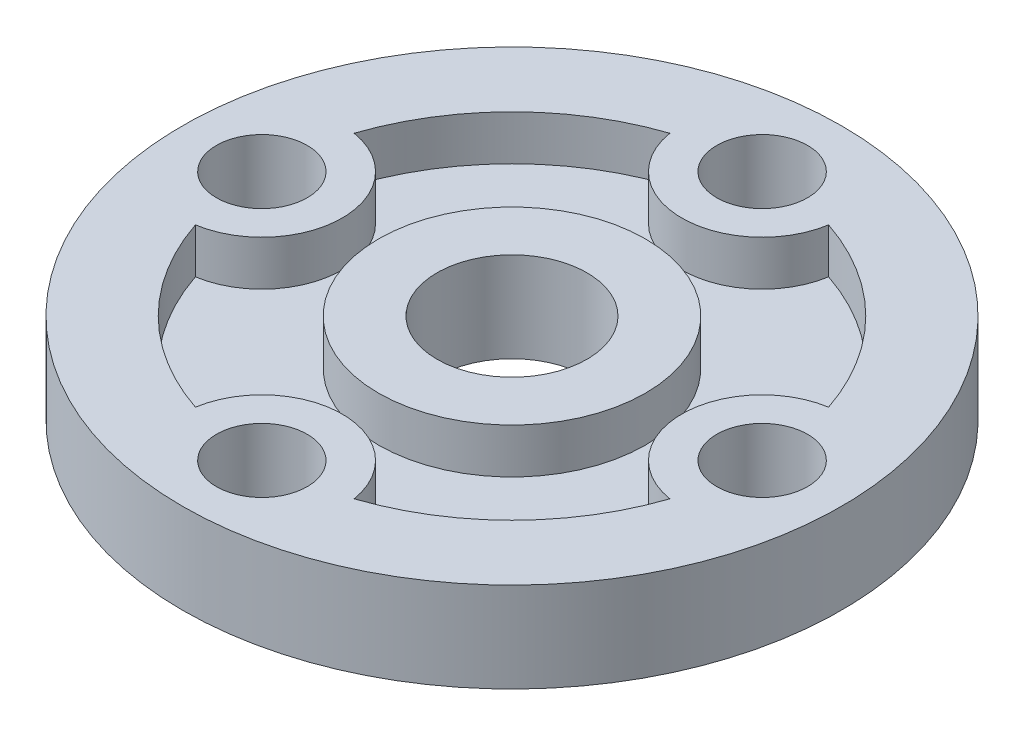
from build123d import *

# Parameters (mm, degrees)
SKETCH1_R           = 73.214752718
BOSS_EXTRUDE4_DEPTH = 20
SKETCH1_7_R         = 10.088971545
SKETCH1_7_R_2       = 16.661107431
CUT_EXTRUDE2_DEPTH  = 20
SKETCH1_8_R         = 29.667707344
CUT_EXTRUDE3_DEPTH  = 10


with BuildPart() as part:
    # Sketch1 → Boss-Extrude4 (new body)
    with BuildSketch(Plane(origin=(0, 0, 0), x_dir=(1, 0, 0), z_dir=(0, 1, 0))):
        Circle(SKETCH1_R)
    extrude(amount=-BOSS_EXTRUDE4_DEPTH)

    # Sketch1<7> → Cut-Extrude2 (cut)
    with BuildSketch(Plane(origin=(0, 0, 0), x_dir=(1, 0, 0), z_dir=(0, 1, 0))):
        with Locations((55.576015856, 0)):
            Circle(SKETCH1_7_R)
        with Locations((0, 55.576015856)):
            Circle(SKETCH1_7_R)
        with Locations((0, -55.576015856)):
            Circle(SKETCH1_7_R)
        with Locations((-55.576015856, 0)):
            Circle(SKETCH1_7_R)
        Circle(SKETCH1_7_R_2)
    extrude(amount=-CUT_EXTRUDE2_DEPTH, mode=Mode.SUBTRACT)

    # Sketch1<8> → Cut-Extrude3 (cut)
    with BuildSketch(Plane(origin=(0, 0, 0), x_dir=(1, 0, 0), z_dir=(0, 1, 0))):
        with BuildLine():
            ThreePointArc((52.703821385, -17.635213348), (37.708440449, 0), (52.703821385, 17.635213348))
            ThreePointArc((52.703821385, 17.635213348), (39.298177683, 39.298177683), (17.635213348, 52.703821385))
            ThreePointArc((17.635213348, 52.703821385), (0, 37.708440449), (-17.635213348, 52.703821385))
            ThreePointArc((-17.635213348, 52.703821385), (-39.298177683, 39.298177683), (-52.703821385, 17.635213348))
            ThreePointArc((-52.703821385, 17.635213348), (-41.96408355, 11.574348786), (-37.708440449, 0))
            ThreePointArc((-37.708440449, 0), (-41.96408355, -11.574348786), (-52.703821385, -17.635213348))
            ThreePointArc((-52.703821385, -17.635213348), (-39.298177683, -39.298177683), (-17.635213348, -52.703821385))
            ThreePointArc((-17.635213348, -52.703821385), (0, -37.708440449), (17.635213348, -52.703821385))
            ThreePointArc((17.635213348, -52.703821385), (39.298177683, -39.298177683), (52.703821385, -17.635213348))
        make_face()
        Circle(SKETCH1_8_R, mode=Mode.SUBTRACT)
    extrude(amount=-CUT_EXTRUDE3_DEPTH, mode=Mode.SUBTRACT)


solid = part.part
